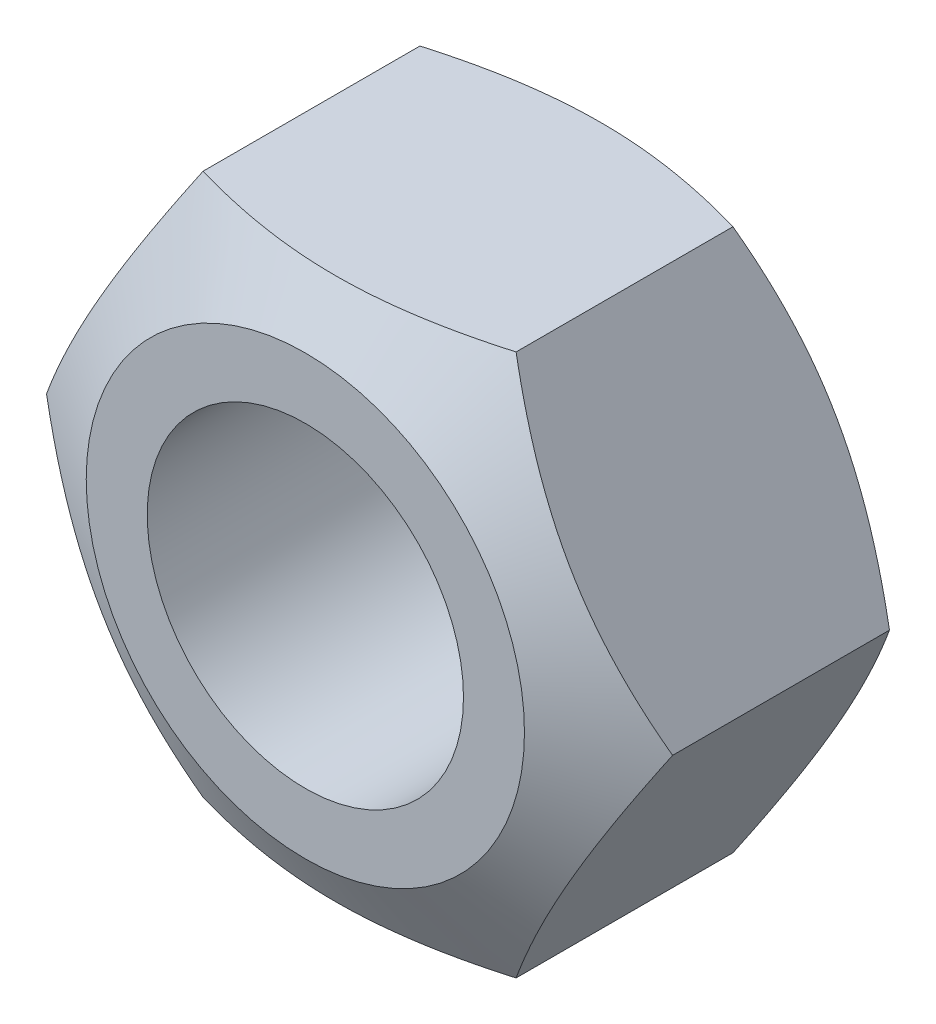
from build123d import *

# Parameters (mm, degrees)
EXTRUDE_1_DEPTH         = 18
HOLE_WIZARD_M20_1_D     = 17.5
HOLE_WIZARD_M20_1_DEPTH = 47.5
HOLE_WIZARD_M20_1_TIP   = 5.257530416


with BuildPart() as part:
    # 草图1 → 拉伸1 (new body)
    with BuildSketch(Plane.XY):
        Polygon((17.320508076, 0), (8.660254038, 15), (-8.660254038, 15), (-17.320508076, 0), (-8.660254038, -15), (8.660254038, -15), align=None)
    extrude(amount=EXTRUDE_1_DEPTH)

    # 草图2 → 切除-旋转1 (revolve, cut)
    with BuildSketch(Plane(origin=(0, 0, 0), x_dir=(1, 0, 0), z_dir=(0, 1, 0)), mode=Mode.PRIVATE) as cut_revolve_1_sk:
        Polygon((1.900444705, 5.902777738), (17.320508076, -3), (20.281011983, 2.127743183), align=None)
        Polygon((17.320508076, -15), (20.281011983, -20.127743183), (1.900444705, -23.902777738), align=None)
    revolve(cut_revolve_1_sk.sketch.rotate(Axis((0, 0, -13.306273389), (0, 0, 1)), 180), axis=Axis((0, 0, -13.306273389), (0, 0, 1)), mode=Mode.SUBTRACT)

    # M20 螺纹孔1
    with Locations(Plane.XY.offset(18)):
        with Locations((0, 0)):
            Hole(HOLE_WIZARD_M20_1_D / 2, depth=HOLE_WIZARD_M20_1_DEPTH)
            with Locations((0, 0, -(HOLE_WIZARD_M20_1_DEPTH + HOLE_WIZARD_M20_1_TIP / 2))):  # 118° drill point
                Cone(0, HOLE_WIZARD_M20_1_D / 2, HOLE_WIZARD_M20_1_TIP, mode=Mode.SUBTRACT)


solid = part.part
